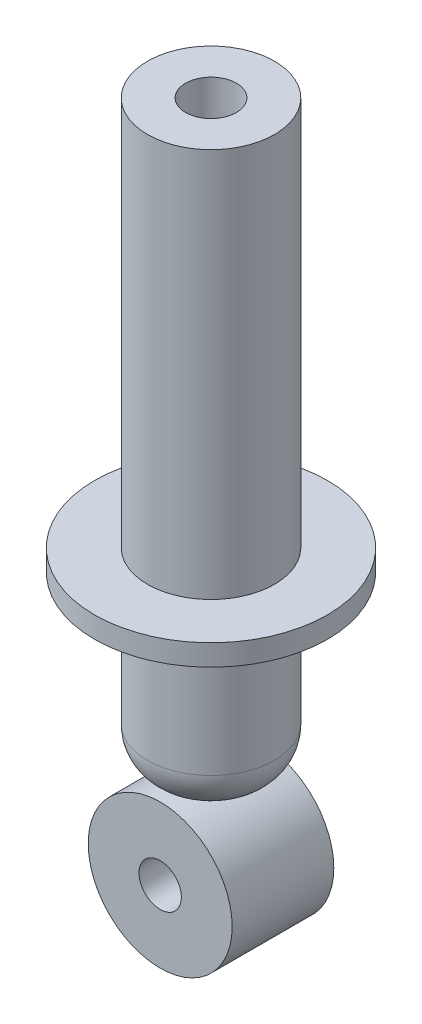
from build123d import *

# Parameters (mm, degrees)
SKETCH_1_R          = 15
EXTRUDE_1_DEPTH     = 136
SKETCH_2_R          = 15
SKETCH_2_R_2        = 6
EXTRUDE_2_DEPTH     = 2
CUT_EXTRUDE_START   = -130
SKETCH_3_R          = 6
CUT_EXTRUDE_1_DEPTH = 130
SKETCH_4_R          = 17
SKETCH_4_R_2        = 5
EXTRUDE_3_DEPTH     = 12
FILLET_1_R          = 10
SKETCH_6_R          = 27.5
SKETCH_6_R_2        = 15
EXTRUDE_4_DEPTH     = 5


with BuildPart() as part:
    # Эскиз1 → Бобышка-Вытянуть1 (new body)
    with BuildSketch(Plane(origin=(0, 0, 0), x_dir=(1, 0, 0), z_dir=(0, 1, 0))):
        with Locations(Location((0, 0, 0), (0, 0, 270))):
            Circle(SKETCH_1_R)
    extrude(amount=EXTRUDE_1_DEPTH)

    # Эскиз2 → Бобышка-Вытянуть2 (add)
    with BuildSketch(Plane(origin=(0, 136, 0), x_dir=(1, 0, 0), z_dir=(0, 1, 0))):
        with Locations(Location((0, 0, 0), (0, 0, 270))):
            Circle(SKETCH_2_R)
        with Locations(Location((0, 0, 0), (0, 0, 270))):
            Circle(SKETCH_2_R_2, mode=Mode.SUBTRACT)
    extrude(amount=EXTRUDE_2_DEPTH)

    # Эскиз3 → Вырез-Вытянуть1 (cut)
    with BuildSketch(Plane(origin=(0, 136, 0), x_dir=(1, 0, 0), z_dir=(0, 1, 0)).offset(CUT_EXTRUDE_START)):
        with Locations(Location((0, 0, 0), (0, 0, 270))):
            Circle(SKETCH_3_R)
    extrude(amount=CUT_EXTRUDE_1_DEPTH, mode=Mode.SUBTRACT)

    # Скругление1
    fillet_1_edges = [part.edges().sort_by_distance(p)[0] for p in [
        (0, 0, -15),
    ]]
    fillet(fillet_1_edges, radius=FILLET_1_R)

    # Эскиз6 → Бобышка-Вытянуть4 (add)
    with BuildSketch(Plane(origin=(0, 41, 0), x_dir=(1, 0, 0), z_dir=(0, 1, 0))):
        with Locations(Location((0, 0, 0), (0, 0, 270))):
            Circle(SKETCH_6_R)
        with Locations(Location((0, 0, 0), (0, 0, 270))):
            Circle(SKETCH_6_R_2, mode=Mode.SUBTRACT)
    extrude(amount=EXTRUDE_4_DEPTH)


with BuildPart() as body_2:
    # Эскиз4 → Бобышка-Вытянуть3 (new, symmetric)
    with BuildSketch(Plane.XY):
        with Locations((0, -17)):
            Circle(SKETCH_4_R)
        with Locations((0, -17)):
            Circle(SKETCH_4_R_2, mode=Mode.SUBTRACT)
    extrude(amount=EXTRUDE_3_DEPTH, both=True)


solid = Compound([part.part, body_2.part])
